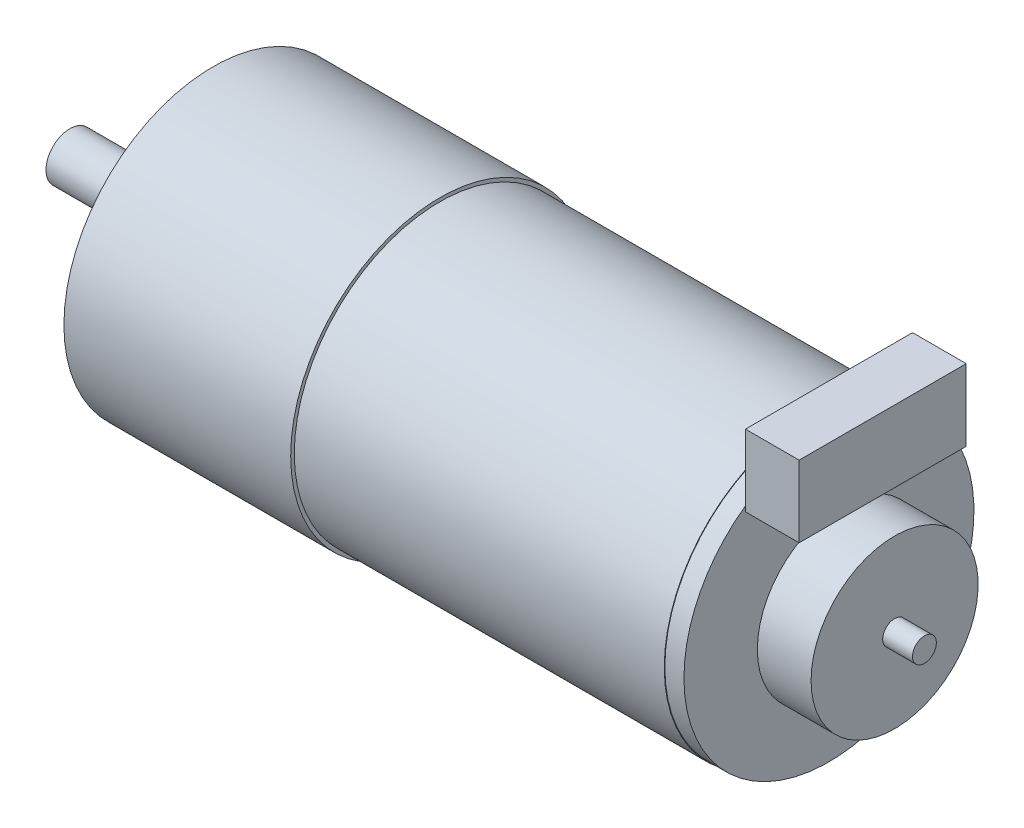
from build123d import *

# Parameters (mm, degrees)
SKETCH_4_R          = 1.5
CUT_EXTRUDE_1_DEPTH = 5
SKETCH_5_W          = 14
SKETCH_5_H          = 6
EXTRUDE_1_DEPTH     = 4.5


with BuildPart() as part:
    # ｽｹｯﾁ3 → 回転1 (revolve)
    with BuildSketch(Plane(origin=(0, 0, 0), x_dir=(1, 0, 0), z_dir=(0, 1, 0))):
        with BuildLine():
            Line((-31, 0), (-31, -2))
            Line((-31, -2), (-21.5, -2))
            Line((-21.5, -2), (-21.5, -3.5))
            Line((-21.5, -3.5), (-19, -3.5))
            Line((-19, -3.5), (-19, -12.5))
            Line((-19, -12.5), (0, -12.5))
            Line((0, -12.5), (0, -12.2))
            Line((0, -12.2), (31, -12.2))
            Line((31, -12.2), (31, -12.15))
            Line((31, -12.15), (32.6, -12.15))
            Line((32.6, -12.15), (32.6, -1))
            add(Edge.make_bspline(
                [(33.6, -1), (33.266666667, -1), (32.933333333, -1), (32.6, -1)],
                knots=[0, 0, 0, 0, 1, 1, 1, 1], degree=3))
            Line((33.6, -1), (33.6, -7))
            Line((33.6, -7), (38.1, -7))
            Line((38.1, -7), (38.1, -1))
            Line((38.1, -1), (40.6, -1))
            Line((40.6, -1), (40.6, 0))
            Line((40.6, 0), (-31, 0))
        make_face()
    revolve(axis=Axis((-48.769222311, 0, 0), (1, 0, 0)))

    # ｽｹｯﾁ4 → ｶｯﾄ - 押し出し1 (cut)
    with BuildSketch(Plane.ZY.offset(19)):
        with Locations((0, 8.5)):
            Circle(SKETCH_4_R)
        with Locations((0, -8.5)):
            Circle(SKETCH_4_R)
    extrude(amount=-CUT_EXTRUDE_1_DEPTH, mode=Mode.SUBTRACT)

    # ｽｹｯﾁ5 → ﾎﾞｽ - 押し出し1 (add)
    with BuildSketch(Plane(origin=(32.6, 0, 0), x_dir=(0, 0, -1), z_dir=(1, 0, 0))):
        with Locations((0, 12.5)):
            Rectangle(SKETCH_5_W, SKETCH_5_H)
    extrude(amount=EXTRUDE_1_DEPTH)


solid = part.part
